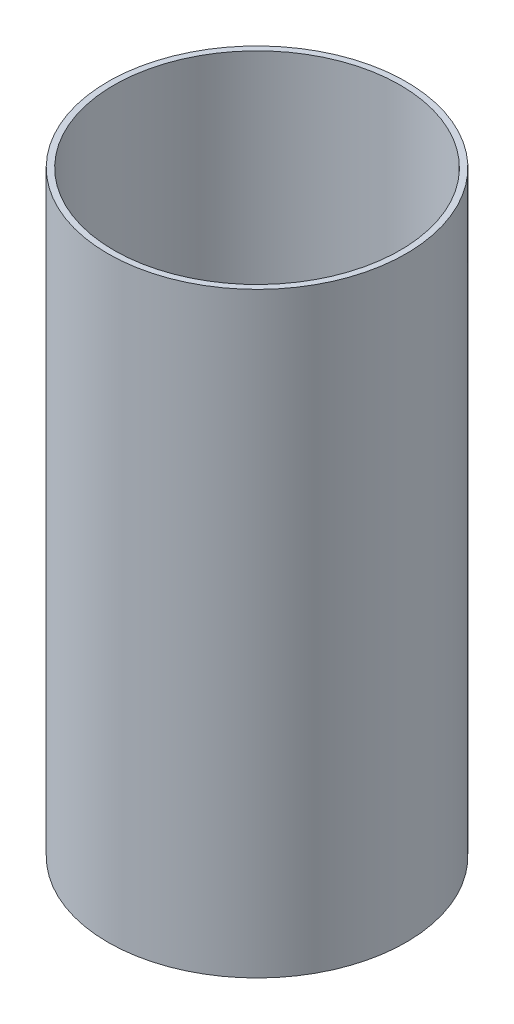
from build123d import *

# Parameters (mm, degrees)
ESQUISSE1_R        = 75
ESQUISSE1_R_2      = 72
BOSS_EXTRU_1_DEPTH = 300


with BuildPart() as part:
    # Esquisse1 → Boss.-Extru.1 (new body)
    with BuildSketch(Plane(origin=(0, 0, 0), x_dir=(1, 0, 0), z_dir=(0, 1, 0))):
        with Locations(Location((0, 0, 0), (0, 0, 270))):
            Circle(ESQUISSE1_R)
        with Locations(Location((0, 0, 0), (0, 0, 270))):
            Circle(ESQUISSE1_R_2, mode=Mode.SUBTRACT)
    extrude(amount=BOSS_EXTRU_1_DEPTH)


solid = part.part
